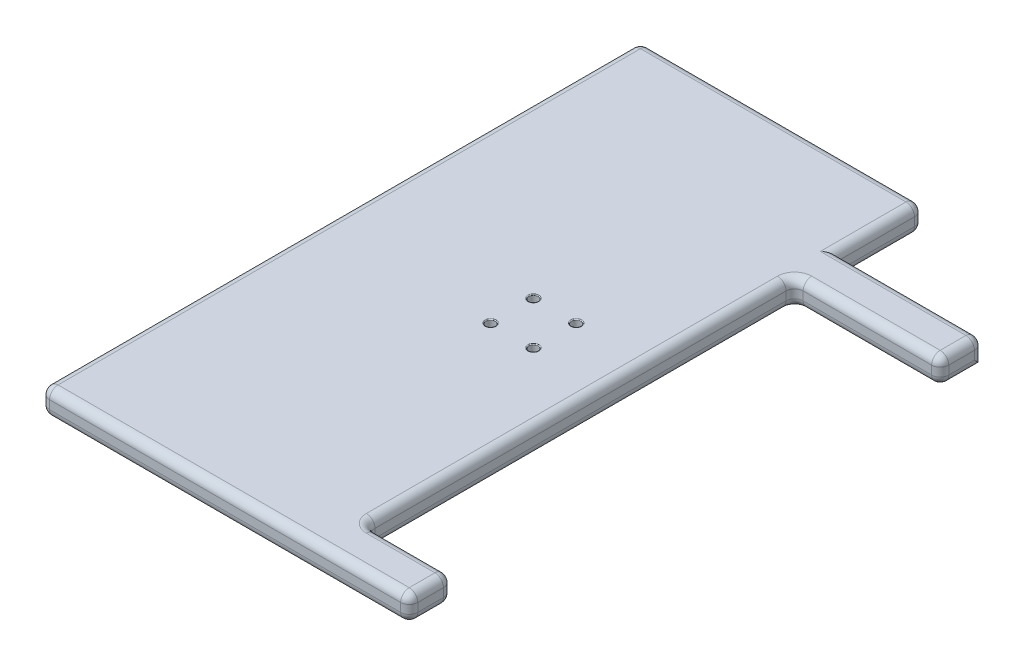
from build123d import *

# Parameters (mm, degrees)
EXTRUDE_1_DEPTH              = 6
HOLE_WIZARD_M2_1_D           = 2.2
HOLE_WIZARD_M2_1_CBORE_D     = 4.6
HOLE_WIZARD_M2_1_CBORE_DEPTH = 3
FILLET1_R                    = 2
FILLET2_R                    = 0.3
FILLET3_R                    = 0.2


with BuildPart() as part:
    # 草图1 → 凸台-拉伸1 (new body)
    with BuildSketch(Plane(origin=(0, 0, 0), x_dir=(1, 0, 0), z_dir=(0, 1, 0))):
        Polygon((26, -60), (26, -70), (-60, -70), (-60, 70), (6, 70), (6, 50), (40, 50), (40, 40), (6, 40), (6, -60), align=None)
    extrude(amount=EXTRUDE_1_DEPTH)

    # M2 六角头机械螺钉的柱形沉头孔1 (through all)
    with Locations(Plane(origin=(0, 0, 0), x_dir=(-1, 0, 0), z_dir=(0, -1, 0))):
        with Locations((10, 5), (20, 5), (20, -5), (10, -5)):
            CounterBoreHole(HOLE_WIZARD_M2_1_D / 2, HOLE_WIZARD_M2_1_CBORE_D / 2, HOLE_WIZARD_M2_1_CBORE_DEPTH)

    # Fillet1
    fillet1_edges = [part.edges().sort_by_distance(p)[0] for p in [
        (-27, 0, -70),
        (6, 0, -60),
        (40, 0, -45),
        (23, 0, -40),
        (6, 0, 10),
        (16, 0, 60),
        (26, 6, 65),
        (26, 0, 65),
        (-17, 0, 70),
        (-60, 0, 0),
        (16, 6, 60),
        (-60, 3, -70),
        (6, 3, -70),
        (40, 3, -50),
        (40, 3, -40),
        (6, 3, -40),
        (6, 3, 60),
        (26, 3, 60),
        (26, 3, 70),
        (-60, 3, 70),
        (6, 6, 10),
        (23, 6, -40),
        (40, 6, -45),
        (23, 6, -50),
        (6, 6, -60),
        (-27, 6, -70),
        (-60, 6, 0),
        (-17, 6, 70),
    ]]
    fillet(fillet1_edges, radius=FILLET1_R)

    # Fillet2
    fillet2_edges = [part.edges().sort_by_distance(p)[0] for p in [
        (-7.7, 0, 5),
        (-17.7, 0, 5),
        (-17.7, 0, -5),
        (-7.7, 0, -5),
    ]]
    fillet(fillet2_edges, radius=FILLET2_R)

    # Fillet3
    fillet3_edges = [part.edges().sort_by_distance(p)[0] for p in [
        (-11.1, 6, 5),
        (-21.1, 6, 5),
        (-21.1, 6, -5),
        (-11.1, 6, -5),
    ]]
    fillet(fillet3_edges, radius=FILLET3_R)


solid = part.part
